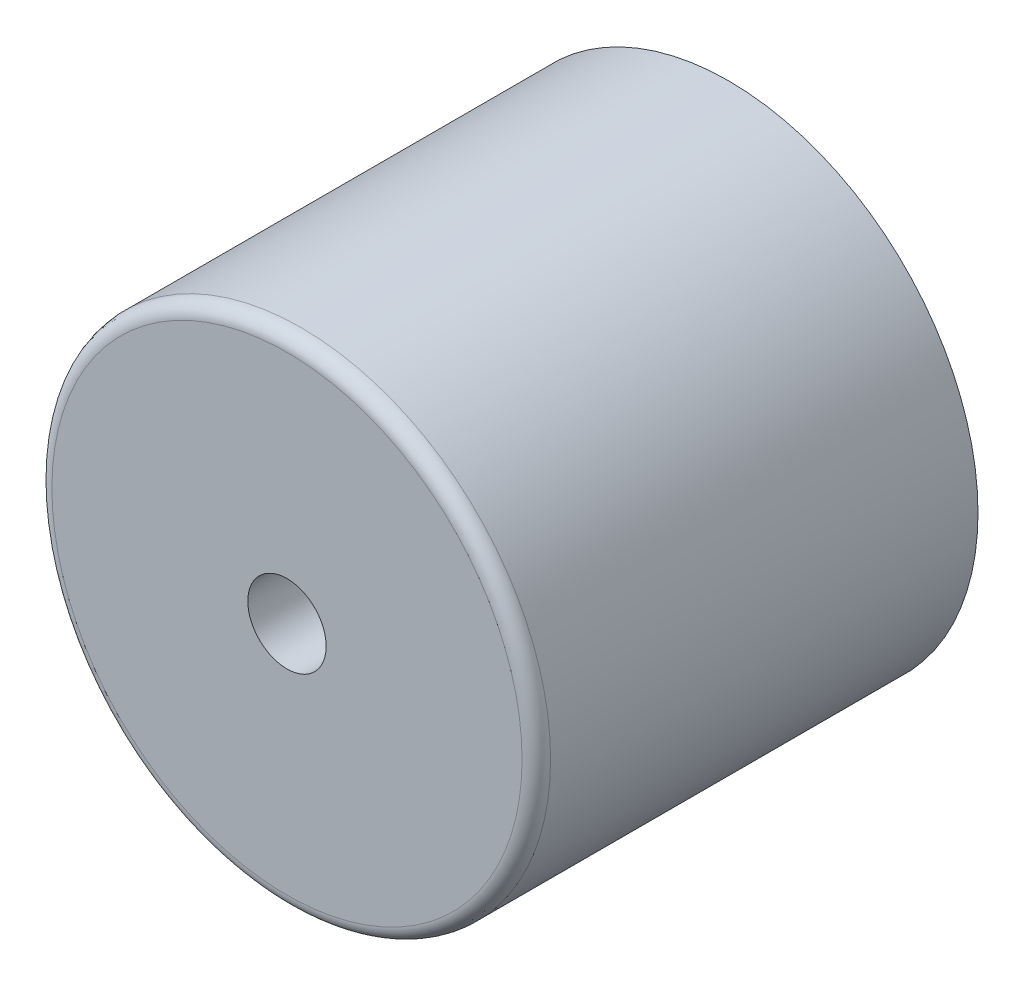
from build123d import *

# Parameters (mm, degrees)
SCHIZZO1_R                   = 17.5
ESTRUSIONE_ESTRUSIONE1_DEPTH = 31
RACCORDO1_R                  = 1
SCHIZZO2_R                   = 14.25
TAGLIO_ESTRUSIONE1_DEPTH     = 14
TAGLIO_ESTRUSIONE2_START     = -4.7
SCHIZZO5_R                   = 0.25
TAGLIO_ESTRUSIONE2_DEPTH     = 4.7
FORO_PER_VITE_M5_1_D         = 5.5


with BuildPart() as part:
    # Schizzo1 → Estrusione-Estrusione1 (new body)
    with BuildSketch(Plane.XY):
        Circle(SCHIZZO1_R)
    extrude(amount=ESTRUSIONE_ESTRUSIONE1_DEPTH)

    # Raccordo1
    raccordo1_edges = [part.edges().sort_by_distance(p)[0] for p in [
        (-17.5, 0, 31),
    ]]
    fillet(raccordo1_edges, radius=RACCORDO1_R)

    # Schizzo2 → Taglio-Estrusione1 (cut)
    with BuildSketch(Plane(origin=(0, 0, 0), x_dir=(-1, 0, 0), z_dir=(0, 0, -1))):
        Circle(SCHIZZO2_R)
    extrude(amount=-TAGLIO_ESTRUSIONE1_DEPTH, mode=Mode.SUBTRACT)

    # Schizzo3 → Taglia-Rivoluzione1 (revolve, cut)
    with BuildSketch(Plane(origin=(0, 0, 0), x_dir=(1, 0, 0), z_dir=(0, 1, 0)), mode=Mode.PRIVATE) as taglia_rivoluzione1_sk:
        Polygon((16, 0), (14.25, 0), (14.25, -6), align=None)
    revolve(taglia_rivoluzione1_sk.sketch.rotate(Axis((0, 0, 0), (0, 0, 1)), 180), axis=Axis((0, 0, 0), (0, 0, 1)), mode=Mode.SUBTRACT)

    # Schizzo4 → Taglia-Rivoluzione2 (revolve, cut)
    with BuildSketch(Plane(origin=(0, 0, 0), x_dir=(1, 0, 0), z_dir=(0, 1, 0)), mode=Mode.PRIVATE) as taglia_rivoluzione2_sk:
        Polygon((0.25, -18.7), (9.25, -14), (0.25, -14), align=None)
    revolve(taglia_rivoluzione2_sk.sketch.rotate(Axis((0, 0, 14), (0, 0, 1)), 180), axis=Axis((0, 0, 14), (0, 0, 1)), mode=Mode.SUBTRACT)

    # Schizzo5 → Taglio-Estrusione2 (cut)
    with BuildSketch(Plane(origin=(0, 0, 14), x_dir=(-1, 0, 0), z_dir=(0, 0, -1)).offset(TAGLIO_ESTRUSIONE2_START)):
        Circle(SCHIZZO5_R)
    extrude(amount=TAGLIO_ESTRUSIONE2_DEPTH, mode=Mode.SUBTRACT)

    # Foro per Vite M5-1 (through all)
    with Locations(Plane.XY.offset(31)):
        with Locations((0, 0)):
            Hole(FORO_PER_VITE_M5_1_D / 2)


solid = part.part
